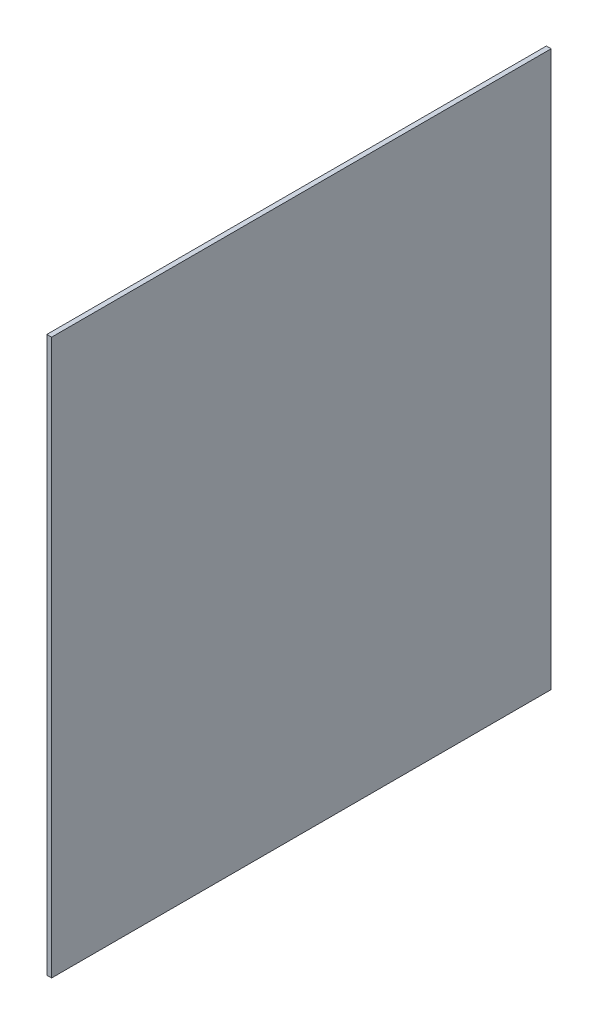
from build123d import *

# Parameters (mm, degrees)
SKETCH_1_W      = 315
SKETCH_1_H      = 350
EXTRUDE_1_DEPTH = 3


with BuildPart() as part:
    # 草图1 → 凸台-拉伸1 (new body)
    with BuildSketch(Plane(origin=(0, 0, 0), x_dir=(0, 0, -1), z_dir=(1, 0, 0))):
        with Locations((157.5, 175)):
            Rectangle(SKETCH_1_W, SKETCH_1_H)
    extrude(amount=EXTRUDE_1_DEPTH)


solid = part.part
